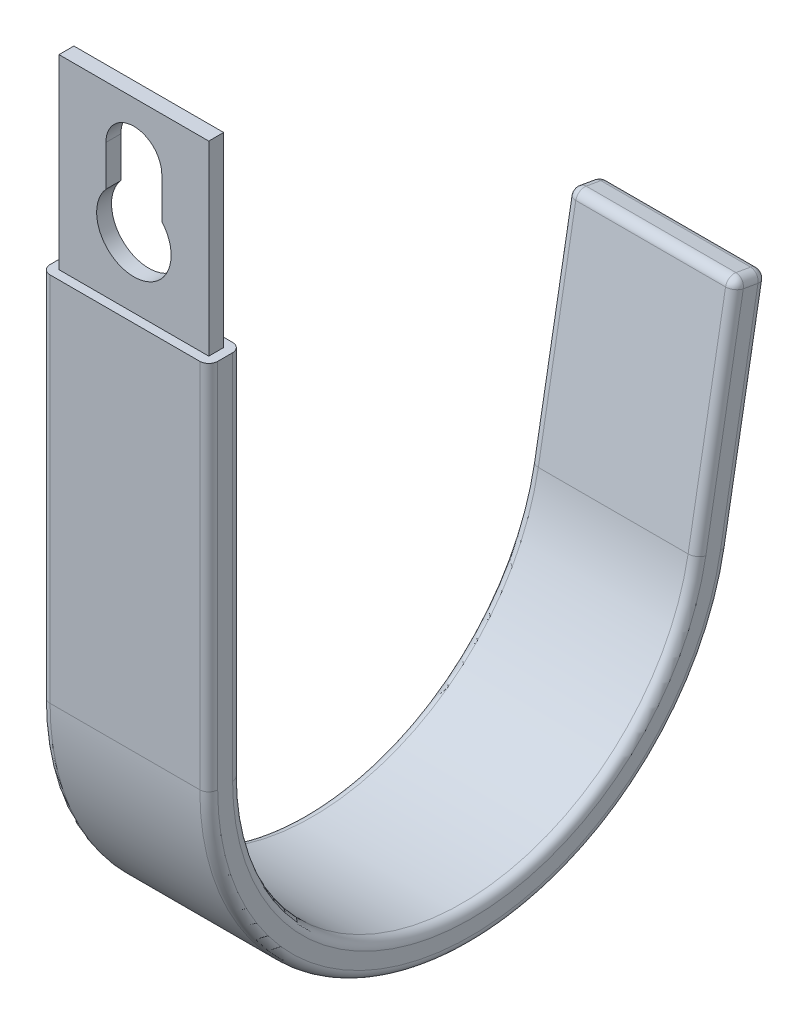
from build123d import *

# Parameters (mm, degrees)
SKETCH6_W          = 28.575
SKETCH6_H          = 5.588000000000008
FILLET1_R          = 1.524
CUT_EXTRUDE1_DEPTH = 133.3733867563125


with BuildPart() as part:
    # Sweep1: sweep along a path in Sketch1
    with BuildLine(Plane(origin=(0, 0, 0), x_dir=(0, 0, -1), z_dir=(1, 0, 0))) as sweep1_path:
        Line((3.9e-16, 94.996), (0, 0))
        ThreePointArc((0, 0), (37.09799061473534, -40.48535253044856), (80.66258708241622, -7.057061940383765))
        Line((80.66258708241622, -7.057061940383765), (87.31250000000001, 30.656468291151832))
    # Sketch2 → Sweep1 (sweep)
    with BuildSketch(Plane(origin=(0, 94.996, -15.113000000000007), x_dir=(1, 0, 0), z_dir=(0, -1, 0))):
        Polygon((-12.763499999999997, 17.653000000000006), (12.763499999999997, 17.65300000000001), (12.763500000000008, 15.113000000000001), (-12.763499999999983, 15.113000000000001), align=None)
    sweep(path=sweep1_path.line)

    # Sweep3: sweep along a path in Sketch5
    with BuildLine(Plane(origin=(0, 0, 0), x_dir=(0, 0, -1), z_dir=(1, 0, 0))) as sweep3_path:
        Line((0, 63.245999999999995), (-3.47e-15, 3.35e-15))
        ThreePointArc((-3.47e-15, 3.35e-15), (37.09799061473534, -40.48535253044856), (80.66258708241622, -7.057061940383765))
        Line((80.66258708241622, -7.057061940383765), (87.31250000000001, 30.656468291151832))
    # Sketch6 → Sweep3 (sweep)
    with BuildSketch(Plane(origin=(0, 44.66337954391292, -7.875358863214053), x_dir=(1, 0, 0), z_dir=(0, 0.9848077530122094, -0.1736481776669233))):
        with Locations((7.11e-15, 81.9325870824162)):
            Rectangle(SKETCH6_W, SKETCH6_H)
        Polygon((-12.763499999999997, 83.2025870824162), (-12.763499999999983, 80.6625870824162), (12.763500000000008, 80.6625870824162), (12.763499999999997, 83.2025870824162), align=None, mode=Mode.SUBTRACT)
    sweep(path=sweep3_path.line)

    # Fillet1
    fillet1_edges = [part.edges().sort_by_distance(p)[0] for p in [
        (-14.287499999999994, 31.622999999999998, -1.5239999999999834),
        (14.287500000000007, 31.622999999999998, 4.064000000000009),
        (-14.287499999999994, -38.96715181055673, -37.23081596668276),
        (14.287500000000007, -44.53388778349341, -36.74378967620887),
        (14.287500000000009, -38.967151810556715, -37.23081596668276),
        (14.287500000000009, 31.622999999999998, -1.5240000000000133),
        (14.287500000000007, 11.09399698134567, -87.98980224944968),
        (14.287500000000009, 12.06434299814844, -82.48669652561743),
        (-14.287499999999996, -44.53388778349341, -36.74378967620887),
        (-14.287499999999996, 31.622999999999998, 4.064000000000009),
        (-14.287499999999994, 12.06434299814843, -82.48669652561752),
        (-14.287499999999996, 11.09399698134567, -87.98980224944968),
        (14.287500000000007, 30.435935105514844, -88.56320584632552),
        (5.33e-15, 29.950762097113483, -91.31475870824151),
        (-14.287499999999994, 30.435935105514847, -88.56320584632554),
        (7.11e-15, 30.92110811391625, -85.81165298440926),
    ]]
    fillet(fillet1_edges, radius=FILLET1_R)

    # Sketch9 → Cut-Extrude1 (cut, through all)
    with BuildSketch(Plane(origin=(0, 0, 0), x_dir=(-1, 0, 0), z_dir=(0, -6e-17, -1))):
        with BuildLine():
            Line((4.7625, 86.03336979368495), (4.762500000000001, 79.121))
            ThreePointArc((4.762500000000001, 79.121), (-7.9e-16, 68.57086979368498), (-4.762500000000001, 79.121))
            Line((-4.762500000000001, 79.121), (-4.7625, 86.03336979368495))
            ThreePointArc((-4.7625, 86.03336979368495), (1.48e-15, 90.79586979368496), (4.7625, 86.03336979368495))
        make_face()
    extrude(amount=-CUT_EXTRUDE1_DEPTH, mode=Mode.SUBTRACT)


solid = part.part
